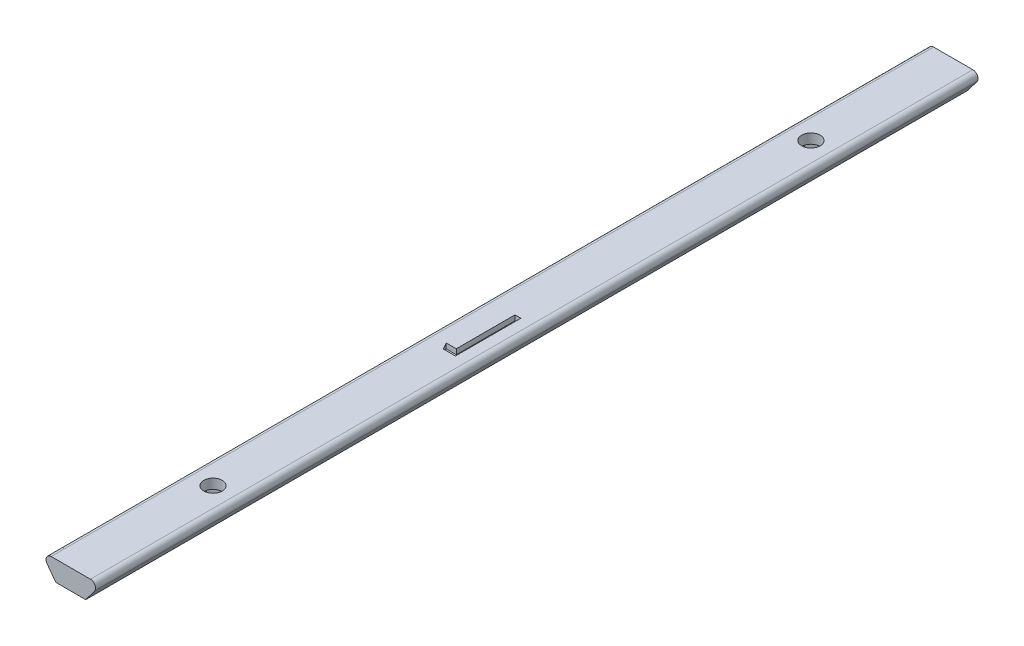
from build123d import *

# Parameters (mm, degrees)
BOSS_EXTRUDE1_DEPTH = 171.2
FILLET1_R           = 1
SKETCH2_R           = 1.8
CUT_EXTRUDE1_DEPTH  = 200
CUT_EXTRUDE2_DEPTH  = 2
LPATTERN1_COUNT     = 3
LPATTERN1_PITCH     = 116
CUT_EXTRUDE3_DEPTH  = 1


with BuildPart() as part:
    # Sketch1 → Boss-Extrude1 (new body)
    with BuildSketch(Plane.XY):
        Polygon((0, 0), (5.8, 0), (8.7, 3.9), (-2.9, 3.9), align=None)
    extrude(amount=BOSS_EXTRUDE1_DEPTH)

    # Fillet1
    fillet1_edges = [part.edges().sort_by_distance(p)[0] for p in [
        (-2.9, 3.9, 85.6),
        (8.7, 3.9, 85.6),
    ]]
    fillet(fillet1_edges, radius=FILLET1_R)

    # Sketch2 → Cut-Extrude1 (cut)
    with BuildSketch(Plane.XZ):
        with Locations(Location((2.9, 143.6, 0), (0, 0, 270))):
            Circle(SKETCH2_R)
    cut_extrude1 = extrude(amount=-CUT_EXTRUDE1_DEPTH, mode=Mode.SUBTRACT)

    # Sketch3 → Cut-Extrude2 (cut)
    with BuildSketch(Plane.XZ):
        Polygon((2.92874321, 146.948508199), (0.01447844, 145.29914645), (-0.014264771, 141.950638251), (2.87125679, 140.251491801), (5.78552156, 141.90085355), (5.814264771, 145.249361749), align=None)
    cut_extrude2 = extrude(amount=-CUT_EXTRUDE2_DEPTH, mode=Mode.SUBTRACT)

    # LPattern1: Cut-Extrude1, Cut-Extrude2 ×3
    with Locations(*[(0, 0, -i * LPATTERN1_PITCH) for i in range(1, LPATTERN1_COUNT)]):
        add(cut_extrude1, mode=Mode.SUBTRACT)
        add(cut_extrude2, mode=Mode.SUBTRACT)

    # Sketch4 → Cut-Extrude3 (cut)
    with BuildSketch(Plane(origin=(0, 3.9, 0), x_dir=(1, 0, 0), z_dir=(0, 1, 0))):
        Polygon((2.277474494, -98.3), (4.625651577, -98.3), (4.625651577, -85.6), (3.485907988, -85.6), (3.485907988, -96.997435897), (1.532061834, -96.997435897), align=None)
    extrude(amount=-CUT_EXTRUDE3_DEPTH, mode=Mode.SUBTRACT)


solid = part.part
